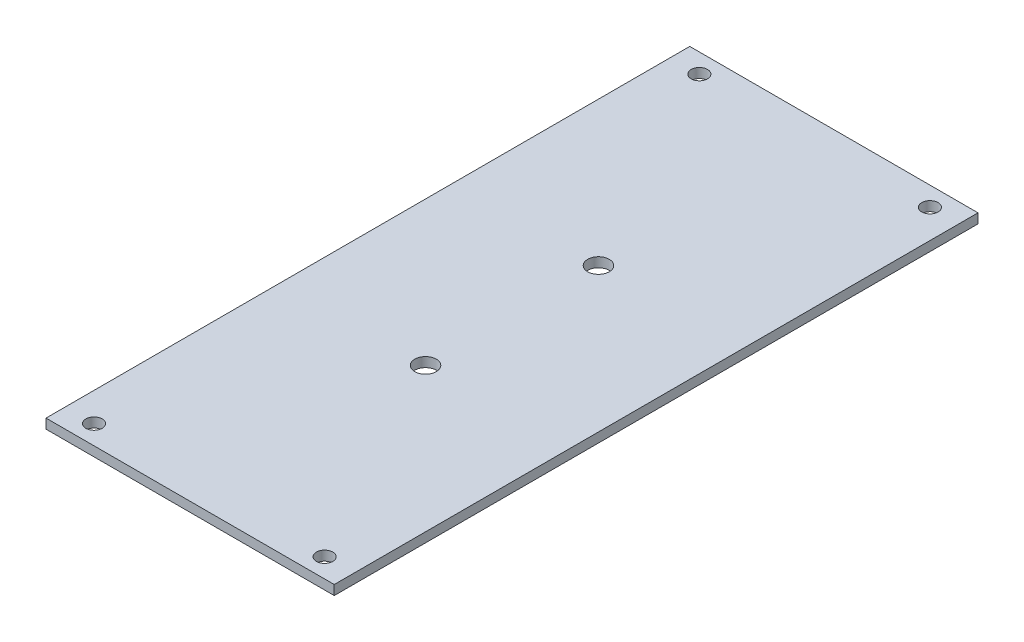
from build123d import *

# Parameters (mm, degrees)
SKETCH1_W                = 60
SKETCH1_H                = 134
BOSS_EXTRUDE1_DEPTH      = 2
M4_CLEARANCE_HOLE1_D     = 4.5
M4_CLEARANCE_HOLE1_DEPTH = 17.38
M4_CLEARANCE_HOLE1_TIP   = 1.351936393
M3_CLEARANCE_HOLE1_D     = 3.4
M3_CLEARANCE_HOLE1_DEPTH = 17.38
M3_CLEARANCE_HOLE1_TIP   = 1.021463052


with BuildPart() as part:
    # Sketch1 → Boss-Extrude1 (new body)
    with BuildSketch(Plane(origin=(0, 0, 0), x_dir=(1, 0, 0), z_dir=(0, 1, 0))):
        Rectangle(SKETCH1_W, SKETCH1_H)
    extrude(amount=BOSS_EXTRUDE1_DEPTH)

    # M4 Clearance Hole1
    with Locations(Plane(origin=(182.343359314, 2, 33.553549243), x_dir=(1, 0, 0), z_dir=(0, 1, 0))):
        with Locations((-182.343359314, 51.553549243), (-182.343359314, 15.553549243)):
            Hole(M4_CLEARANCE_HOLE1_D / 2, depth=M4_CLEARANCE_HOLE1_DEPTH)
            with Locations((0, 0, -(M4_CLEARANCE_HOLE1_DEPTH + M4_CLEARANCE_HOLE1_TIP / 2))):  # 118° drill point
                Cone(0, M4_CLEARANCE_HOLE1_D / 2, M4_CLEARANCE_HOLE1_TIP, mode=Mode.SUBTRACT)

    # M3 Clearance Hole1
    with Locations(Plane(origin=(182.343359314, 2, 33.553549243), x_dir=(1, 0, 0), z_dir=(0, 1, 0))):
        with Locations((-206.343359314, 96.553549243), (-158.343359314, 96.553549243), (-158.343359314, -29.446450757), (-206.343359314, -29.446450757)):
            Hole(M3_CLEARANCE_HOLE1_D / 2, depth=M3_CLEARANCE_HOLE1_DEPTH)
            with Locations((0, 0, -(M3_CLEARANCE_HOLE1_DEPTH + M3_CLEARANCE_HOLE1_TIP / 2))):  # 118° drill point
                Cone(0, M3_CLEARANCE_HOLE1_D / 2, M3_CLEARANCE_HOLE1_TIP, mode=Mode.SUBTRACT)


solid = part.part
